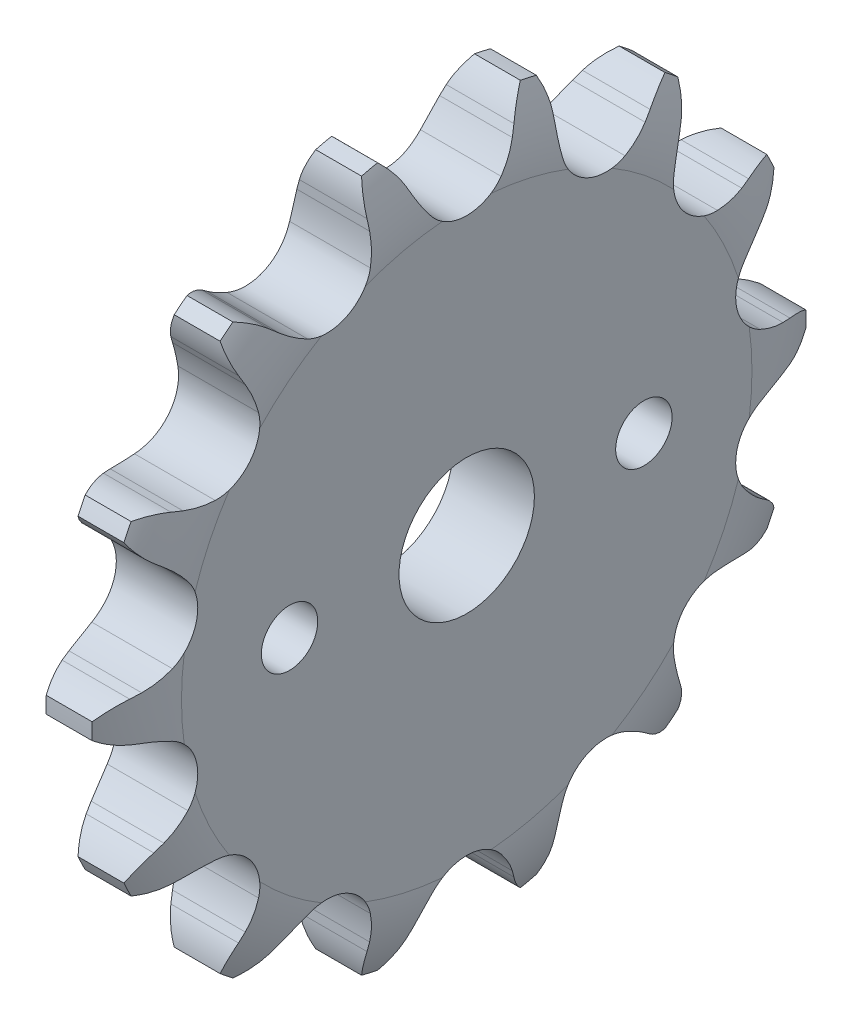
from build123d import *

# Parameters (mm, degrees)
TOOTHCUT_DEPTH     = 46.311767019
TEETHCUTS_COUNT    = 14
TEETHCUTS_ANGLE    = 334.285714286
BORSKE_R           = 1.19126
BORE_DEPTH         = 50.800002
SKETCH2_R          = 6
SKETCH2_R_2        = 2.5
CUT_EXTRUDE1_DEPTH = 10


with BuildPart() as part:
    # BasProSke → Base-Revolve (revolve)
    with BuildSketch(Plane(origin=(0, 0, 0), x_dir=(1, 0, 0), z_dir=(0, 1, 0)), mode=Mode.PRIVATE) as base_revolve_sk:
        with BuildLine():
            Line((0, 0), (0, 25.281167832))
            ThreePointArc((0, 25.281167832), (0.399574234, 28.552348622), (1.5748, 31.631167832))
            Line((1.5748, 31.631167832), (5.642864, 31.631167832))
            ThreePointArc((5.642864, 31.631167832), (6.818089766, 28.552348622), (7.217664, 25.281167832))
            Line((7.217664, 25.281167832), (7.217664, 0))
            Line((7.217664, 0), (0, 0))
        make_face()
    revolve(base_revolve_sk.sketch.rotate(Axis((-10, 0, 0), (1, 0, 0)), 180), axis=Axis((-10, 0, 0), (1, 0, 0)))

    # TooCutSke → ToothCut (cut, through all)
    with BuildSketch(Plane(origin=(0, 0, 0), x_dir=(0, 0, -1), z_dir=(1, 0, 0))):
        with BuildLine():
            Line((4.427418776, 28.141427154), (4.792226358, 28.913681858))
            ThreePointArc((4.792226358, 28.913681858), (7.25071659, 31.695992295), (10.816552206, 32.73051728))
            ThreePointArc((10.816552206, 32.73051728), (0, 34.471503638), (-10.816552206, 32.73051728))
            ThreePointArc((-10.816552206, 32.73051728), (-7.25071659, 31.695992295), (-4.792226358, 28.913681858))
            Line((-4.792226358, 28.913681858), (-4.427418776, 28.141427154))
            ThreePointArc((-4.427418776, 28.141427154), (-3.820455474, 27.036712644), (-3.083385552, 26.014202727))
            ThreePointArc((-3.083385552, 26.014202727), (0, 24.552928999), (3.083385552, 26.014202727))
            ThreePointArc((3.083385552, 26.014202727), (3.820455474, 27.036712644), (4.427418776, 28.141427154))
        make_face()
    toothcut = extrude(amount=TOOTHCUT_DEPTH, mode=Mode.SUBTRACT)

    # TeethCuts: ToothCut ×14 about axis
    teethcuts_axis = Axis((-10, 0, 0), (1, 0, 0))
    for i in range(1, TEETHCUTS_COUNT):
        add(toothcut.rotate(teethcuts_axis, i * TEETHCUTS_ANGLE / (TEETHCUTS_COUNT - 1)), mode=Mode.SUBTRACT)

    # BorSke → Bore (cut, symmetric)
    with BuildSketch(Plane(origin=(0, 0, 0), x_dir=(0, 0, -1), z_dir=(1, 0, 0))):
        with Locations(Location((0, 0, 0), (0, 0, 180))):
            Circle(BORSKE_R)
    extrude(amount=BORE_DEPTH, both=True, mode=Mode.SUBTRACT)

    # Sketch2 → Cut-Extrude1 (cut)
    with BuildSketch(Plane(origin=(7.217664, 0, 0), x_dir=(0, 0, -1), z_dir=(1, 0, 0))):
        Circle(SKETCH2_R)
        with Locations((-15.702797777, 0)):
            Circle(SKETCH2_R_2)
        with Locations((15.702797777, 0)):
            Circle(SKETCH2_R_2)
    extrude(amount=-CUT_EXTRUDE1_DEPTH, mode=Mode.SUBTRACT)


solid = part.part
